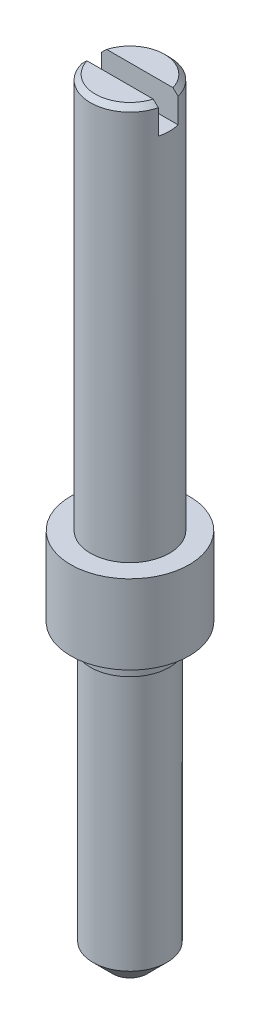
from build123d import *

# Parameters (mm, degrees)
ESQUISSE1_R             = 3
BOSS_EXTRU_1_DEPTH      = 4
ESQUISSE2_R             = 2
BOSS_EXTRU_2_DEPTH      = 20
CHANFREIN1_SIZE         = 0.25
ENL_V_START             = -1.5
ENL_V_MAT_EXTRU_1_DEPTH = 1.5
BOSS_EXTRU_3_START      = 1
ESQUISSE4_R             = 2
BOSS_EXTRU_3_DEPTH      = 1
ESQUISSE5_R             = 1.875
BOSS_EXTRU_4_DEPTH      = 14
CHANFREIN2_SIZE         = 1


with BuildPart() as part:
    # Esquisse1 → Boss.-Extru.1 (new body)
    with BuildSketch(Plane(origin=(0, 0, 0), x_dir=(1, 0, 0), z_dir=(0, 1, 0))):
        with Locations(Location((0, 0, 0), (0, 0, 270))):
            Circle(ESQUISSE1_R)
    extrude(amount=BOSS_EXTRU_1_DEPTH)

    # Esquisse2 → Boss.-Extru.2 (add)
    with BuildSketch(Plane(origin=(0, 4, 0), x_dir=(1, 0, 0), z_dir=(0, 1, 0))):
        with Locations(Location((0, 0, 0), (0, 0, 270))):
            Circle(ESQUISSE2_R)
    extrude(amount=BOSS_EXTRU_2_DEPTH)

    # Chanfrein1
    chanfrein1_edges = [part.edges().sort_by_distance(p)[0] for p in [
        (0, 24, -2),
    ]]
    chamfer(chanfrein1_edges, length=CHANFREIN1_SIZE)

    # Esquisse3 → Enlèv. mat.-Extru.1 (cut)
    with BuildSketch(Plane(origin=(0, 24, 0), x_dir=(1, 0, 0), z_dir=(0, 1, 0)).offset(ENL_V_START)):
        with BuildLine():
            Line((-1.936491673, -0.5), (1.936491673, -0.5))
            ThreePointArc((1.936491673, -0.5), (2, 0), (1.936491673, 0.5))
            Line((1.936491673, 0.5), (-1.936491673, 0.5))
            ThreePointArc((-1.936491673, 0.5), (-2, 0), (-1.936491673, -0.5))
        make_face()
    extrude(amount=ENL_V_MAT_EXTRU_1_DEPTH, mode=Mode.SUBTRACT)

    # Esquisse4 → Boss.-Extru.3 (add)
    with BuildSketch(Plane.XZ.offset(BOSS_EXTRU_3_START)):
        with Locations(Location((0, 0, 0), (0, 0, 194.477512186))):
            Circle(ESQUISSE4_R)
    extrude(amount=-BOSS_EXTRU_3_DEPTH)

    # Esquisse5 → Boss.-Extru.4 (add)
    with BuildSketch(Plane.XZ.offset(1)):
        with Locations(Location((0, 0, 0), (0, 0, 270))):
            Circle(ESQUISSE5_R)
    extrude(amount=BOSS_EXTRU_4_DEPTH)

    # Chanfrein2
    chanfrein2_edges = [part.edges().sort_by_distance(p)[0] for p in [
        (0, -15, 1.875),
    ]]
    chamfer(chanfrein2_edges, length=CHANFREIN2_SIZE)


solid = part.part
